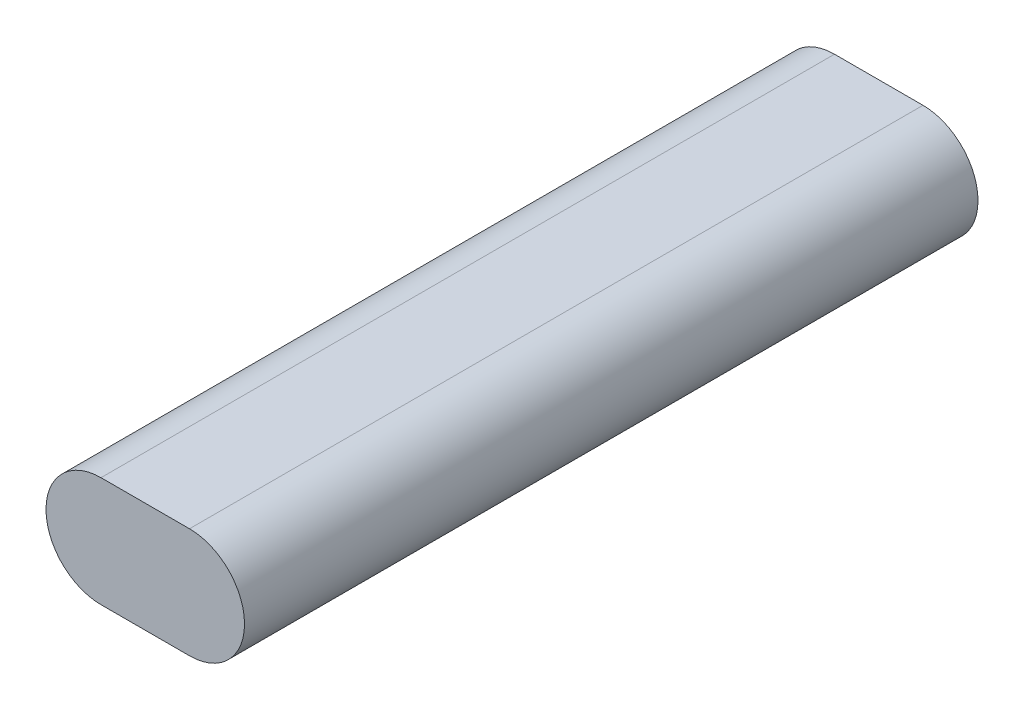
from build123d import *

# Parameters (mm, degrees)
BOSS_EXTRUDE1_DEPTH = 109


with BuildPart() as part:
    # Sketch1 → Boss-Extrude1 (new body)
    with BuildSketch(Plane.XY):
        with BuildLine():
            Line((-6.575, 8.175), (6.575, 8.175))
            ThreePointArc((6.575, 8.175), (14.75, 0), (6.575, -8.175))
            Line((6.575, -8.175), (-6.575, -8.175))
            ThreePointArc((-6.575, -8.175), (-14.75, 0), (-6.575, 8.175))
        make_face()
    extrude(amount=BOSS_EXTRUDE1_DEPTH)


solid = part.part
